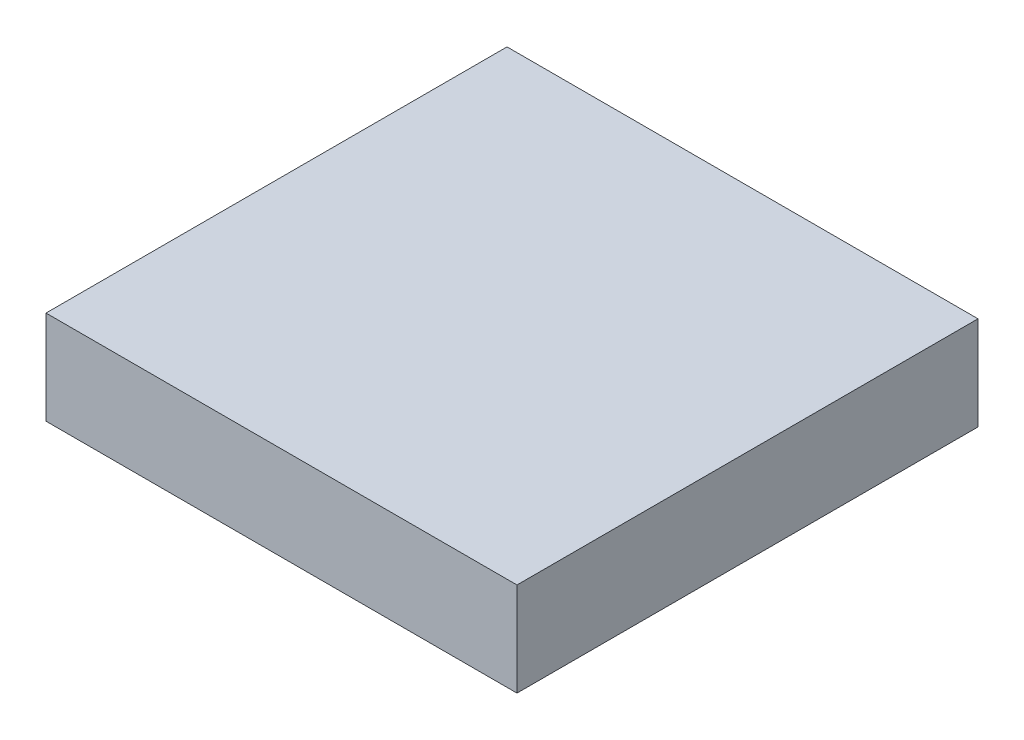
from build123d import *

# Parameters (mm, degrees)
SKETCH1_W               = 1.0216
SKETCH1_H               = 0.2032
COMPONENT_OUTLINE_DEPTH = 1


with BuildPart() as part:
    # Sketch1 → Component_Outline (new body)
    with BuildSketch(Plane.XY):
        with Locations((0.0508, 0.17)):
            Rectangle(SKETCH1_W, SKETCH1_H)
    extrude(amount=COMPONENT_OUTLINE_DEPTH)


solid = part.part
